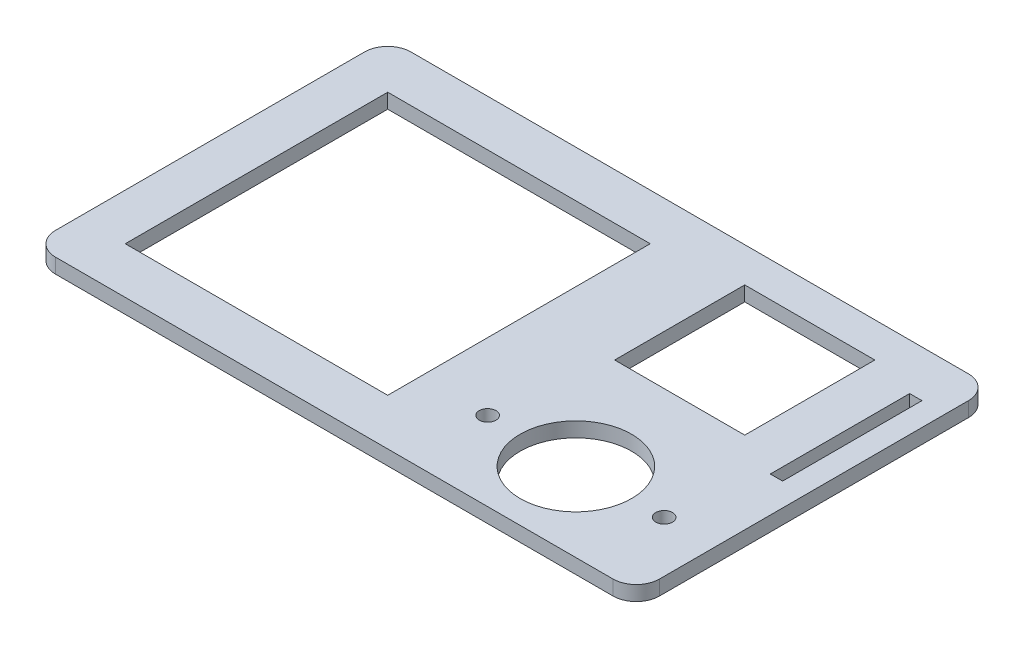
from build123d import *

# Parameters (mm, degrees)
SKETCH1_W           = 130
SKETCH1_H           = 76.5
SKETCH1_R           = 12
SKETCH1_R_2         = 1.8
SKETCH1_W_2         = 56.5
SKETCH1_H_2         = 56.5
SKETCH1_W_3         = 28
SKETCH1_H_3         = 28
SKETCH1_W_4         = 2.65
SKETCH1_H_4         = 30
BOSS_EXTRUDE1_DEPTH = 3.175
FILLET1_R           = 5


with BuildPart() as part:
    # Sketch1 → Boss-Extrude1 (new body)
    with BuildSketch(Plane(origin=(0, 0, 0), x_dir=(1, 0, 0), z_dir=(0, 1, 0))):
        with Locations((65, 38.25)):
            Rectangle(SKETCH1_W, SKETCH1_H)
        with Locations(Location((100, 17, 0), (0, 0, 270))):
            Circle(SKETCH1_R, mode=Mode.SUBTRACT)
        with Locations(Location((119, 17, 0), (0, 0, 270))):
            Circle(SKETCH1_R_2, mode=Mode.SUBTRACT)
        with Locations(Location((81, 17, 0), (0, 0, 90))):
            Circle(SKETCH1_R_2, mode=Mode.SUBTRACT)
        with Locations((38.25, 38.25)):
            Rectangle(SKETCH1_W_2, SKETCH1_H_2, mode=Mode.SUBTRACT)
        with Locations((98.35, 55)):
            Rectangle(SKETCH1_W_3, SKETCH1_H_3, mode=Mode.SUBTRACT)
        with Locations((123.675, 51.5)):
            Rectangle(SKETCH1_W_4, SKETCH1_H_4, mode=Mode.SUBTRACT)
    extrude(amount=BOSS_EXTRUDE1_DEPTH)

    # Fillet1
    fillet1_edges = [part.edges().sort_by_distance(p)[0] for p in [
        (0, 1.5875, -76.5),
        (130, 1.5875, -76.5),
        (130, 1.5875, 0),
        (0, 1.5875, 0),
    ]]
    fillet(fillet1_edges, radius=FILLET1_R)


solid = part.part
